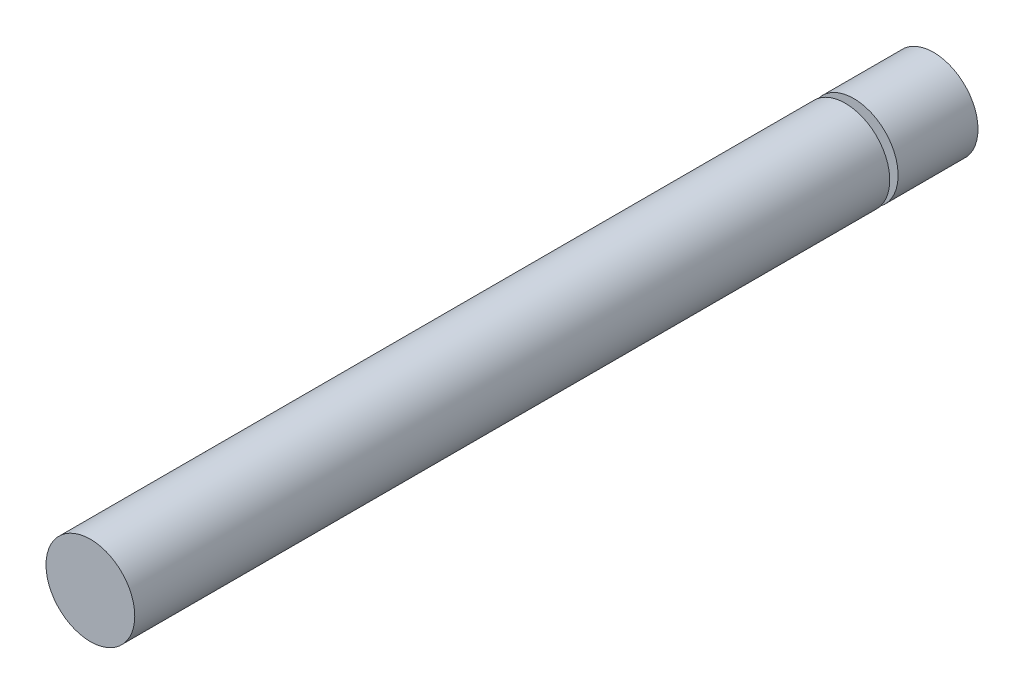
from build123d import *

# Parameters (mm, degrees)
SKETCH1_R           = 5
BOSS_EXTRUDE1_DEPTH = 47.5
SKETCH2_W           = 1.5
SKETCH2_H           = 0.94


with BuildPart() as part:
    # Sketch1 → Boss-Extrude1 (new, symmetric)
    with BuildSketch(Plane.XY):
        Circle(SKETCH1_R)
    extrude(amount=BOSS_EXTRUDE1_DEPTH, both=True)

    # Sketch2 → Cut-Revolve1 (revolve, cut)
    with BuildSketch(Plane(origin=(0, 0, 0), x_dir=(1, 0, 0), z_dir=(0, 1, 0))):
        with Locations((-4.25, 38.03)):
            Rectangle(SKETCH2_W, SKETCH2_H)
    revolve(axis=Axis((0, 0, -47.5), (0, 0, 1)), mode=Mode.SUBTRACT)


solid = part.part
